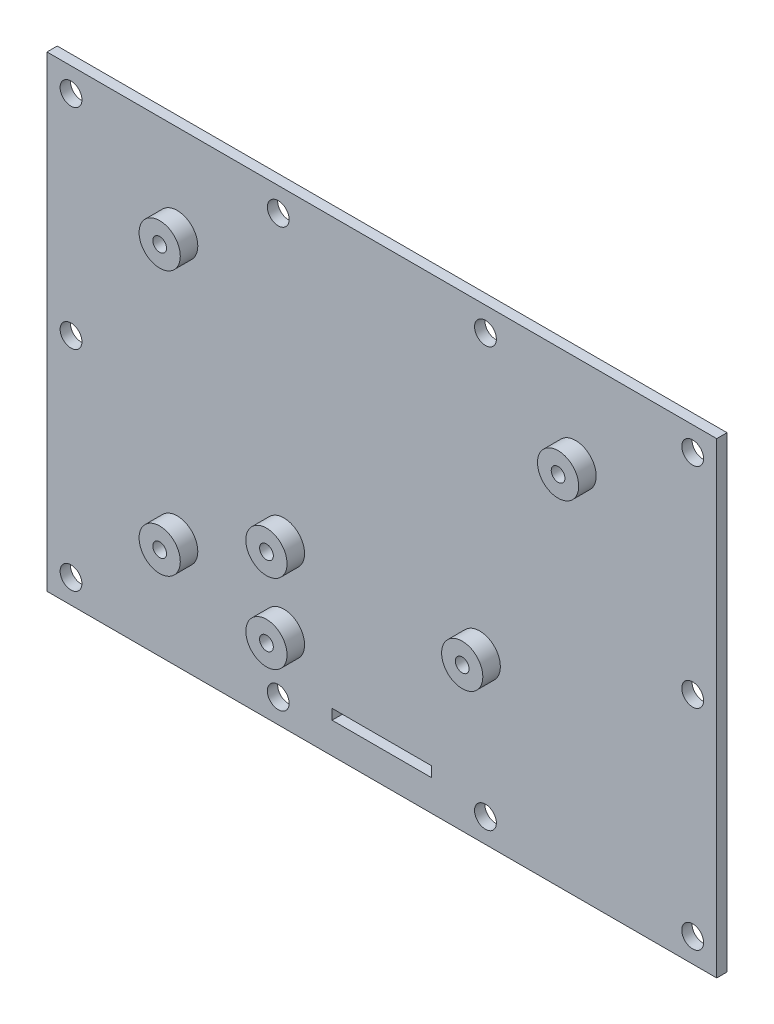
from build123d import *

# Parameters (mm, degrees)
SKETCH1_W           = 195
SKETCH1_H           = 136
SKETCH1_W_2         = 29
SKETCH1_H_2         = 3
BOSS_EXTRUDE1_DEPTH = 1.5
SKETCH1_3_W         = 195
SKETCH1_3_H         = 136
SKETCH1_3_W_2       = 29
SKETCH1_3_H_2       = 3
BOSS_EXTRUDE2_DEPTH = 1.5
SKETCH2_R           = 3.175
CUT_EXTRUDE1_DEPTH  = 119.908578328
SKETCH3_R           = 6
SKETCH3_R_2         = 2
BOSS_EXTRUDE3_DEPTH = 5.1
SKETCH4_R           = 6
SKETCH4_R_2         = 2
BOSS_EXTRUDE6_DEPTH = 5.1


with BuildPart() as part:
    # Sketch1 → Boss-Extrude1 (new body)
    with BuildSketch(Plane.XY):
        Rectangle(SKETCH1_W, SKETCH1_H)
        with Locations((0, -57.5)):
            Rectangle(SKETCH1_W_2, SKETCH1_H_2, mode=Mode.SUBTRACT)
    extrude(amount=-BOSS_EXTRUDE1_DEPTH)

    # Sketch1<3> → Boss-Extrude2 (add)
    with BuildSketch(Plane.XY):
        Rectangle(SKETCH1_3_W, SKETCH1_3_H)
        with Locations((0, -57.5)):
            Rectangle(SKETCH1_3_W_2, SKETCH1_3_H_2, mode=Mode.SUBTRACT)
    extrude(amount=BOSS_EXTRUDE2_DEPTH)

    # Sketch2 → Cut-Extrude1 (cut, through all)
    with BuildSketch(Plane.XY.offset(1.5)):
        with Locations((-90.5, 61)):
            Circle(SKETCH2_R)
        with Locations((90.5, 61)):
            Circle(SKETCH2_R)
        with Locations((90.5, -61)):
            Circle(SKETCH2_R)
        with Locations((-90.5, -61)):
            Circle(SKETCH2_R)
        with Locations((-90.5, 0)):
            Circle(SKETCH2_R)
        with Locations((30.166666667, 61)):
            Circle(SKETCH2_R)
        with Locations((90.5, 0)):
            Circle(SKETCH2_R)
        with Locations((30.166666667, -61)):
            Circle(SKETCH2_R)
        with Locations((-30.166666667, -61)):
            Circle(SKETCH2_R)
        with Locations((-30.166666667, 61)):
            Circle(SKETCH2_R)
    extrude(amount=-CUT_EXTRUDE1_DEPTH, mode=Mode.SUBTRACT)

    # Sketch3 → Boss-Extrude3 (add)
    with BuildSketch(Plane.XY.offset(1.5)):
        with Locations((-28.5, -44)):
            Circle(SKETCH3_R)
        with Locations((-28.5, -44)):
            Circle(SKETCH3_R_2, mode=Mode.SUBTRACT)
    boss_extrude3 = extrude(amount=BOSS_EXTRUDE3_DEPTH)

    # Sketch-Pattern1: Boss-Extrude3 at 2 more places
    with Locations((0, 23, 0), (57, 23, 0)):
        add(boss_extrude3)

    # Sketch4 → Boss-Extrude6 (add)
    with BuildSketch(Plane.XY.offset(1.5)):
        with Locations((-59.585970737, -36.007477459)):
            Circle(SKETCH4_R)
        with Locations((-59.585970737, -36.007477459)):
            Circle(SKETCH4_R_2, mode=Mode.SUBTRACT)
    boss_extrude6 = extrude(amount=BOSS_EXTRUDE6_DEPTH)

    # Sketch-Pattern2: Boss-Extrude6 at 2 more places
    with Locations((0, 77, 0), (116, 77, 0)):
        add(boss_extrude6)


solid = part.part
